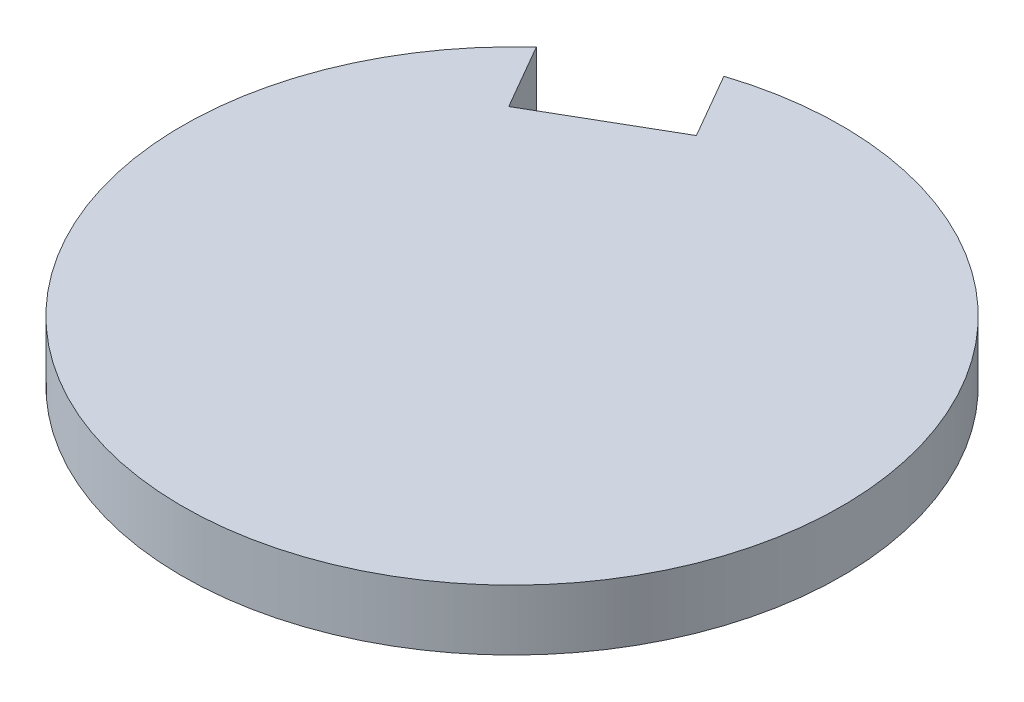
from build123d import *

# Parameters (mm, degrees)
BOSS_EXTRUDE1_DEPTH      = 13.9999974
BOSS_EXTRUDE1_DEPTH_BACK = 13.9999974
SKETCH4_R                = 152.4
CUT_EXTRUDE2_DEPTH       = 218.337340806
CUT_EXTRUDE2_DEPTH_BACK  = 218.337340806
SKETCH9_R                = 8.89
CUT_EXTRUDE4_DEPTH       = 41.91


with BuildPart() as part:
    # Sketch4 → Boss-Extrude1 (new, two sides: drawn at the far end of the back side and taken through both)
    with BuildSketch(Plane(origin=(0, 0, 0), x_dir=(1, 0, 0), z_dir=(0, 1, 0)).offset(-BOSS_EXTRUDE1_DEPTH_BACK)):
        with Locations(Location((0, 0, 0), (0, 0, 270))):
            Circle(SKETCH4_R)
    extrude(amount=BOSS_EXTRUDE1_DEPTH + BOSS_EXTRUDE1_DEPTH_BACK)

    # Sketch7 → Cut-Extrude2 (cut, two sides: drawn at the far end of the back side and taken through both)
    with BuildSketch(Plane(origin=(0, 13.9999974, 0), x_dir=(1, 0, 0), z_dir=(0, 1, 0)).offset(-CUT_EXTRUDE2_DEPTH_BACK)):
        Polygon((-48.70369343, 147.857271537), (-103.69630657, 116.107271537), (-84.64630657, 83.111703653), (-29.65369343, 114.861703653), align=None)
    extrude(amount=CUT_EXTRUDE2_DEPTH + CUT_EXTRUDE2_DEPTH_BACK, mode=Mode.SUBTRACT)

    # Sketch9 → Cut-Extrude4 (cut)
    with BuildSketch(Plane(origin=(0, 0, 0), x_dir=(-0.500000000000002, 0, -0.8660254037844375), z_dir=(0.8660254037844375, 0, -0.500000000000002))):
        with Locations((134.218010674, 0)):
            Circle(SKETCH9_R)
    extrude(amount=CUT_EXTRUDE4_DEPTH, mode=Mode.SUBTRACT)


solid = part.part
